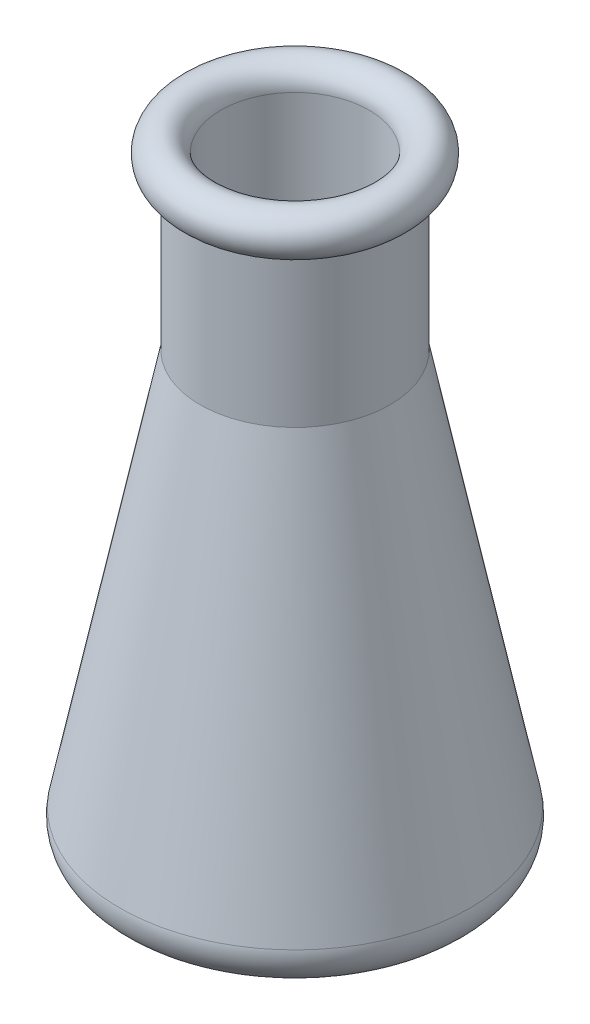
from build123d import *

# Parameters (mm, degrees)
FILLET1_R = 4


with BuildPart() as part:
    # Sketch1 → Revolve1 (revolve)
    with BuildSketch(Plane.XY, mode=Mode.PRIVATE) as revolve1_sk:
        with BuildLine():
            ThreePointArc((12.609380103, 0), (10.129852422, -0.034707115), (8.9, -2.188012744))
            Line((8.9, -2.188012744), (8.9, -27.380086709))
            Line((8.9, -27.380086709), (0, -27.380086709))
            Line((0, -27.380086709), (0, -75))
            Line((0, -75), (22, -75))
            Line((22, -75), (11.4, -22.688012744))
            Line((11.4, -22.688012744), (11.4, -4.688012744))
            ThreePointArc((11.4, -4.688012744), (13.820746978, -2.81249979), (12.609380103, 0))
        make_face()
    revolve(revolve1_sk.sketch.rotate(Axis((0, -27.380086709, 0), (0, -1, 0)), 180), axis=Axis((0, -27.380086709, 0), (0, -1, 0)))

    # Fillet1
    fillet1_edges = [part.edges().sort_by_distance(p)[0] for p in [
        (22, -75, 0),
    ]]
    fillet(fillet1_edges, radius=FILLET1_R)


solid = part.part
